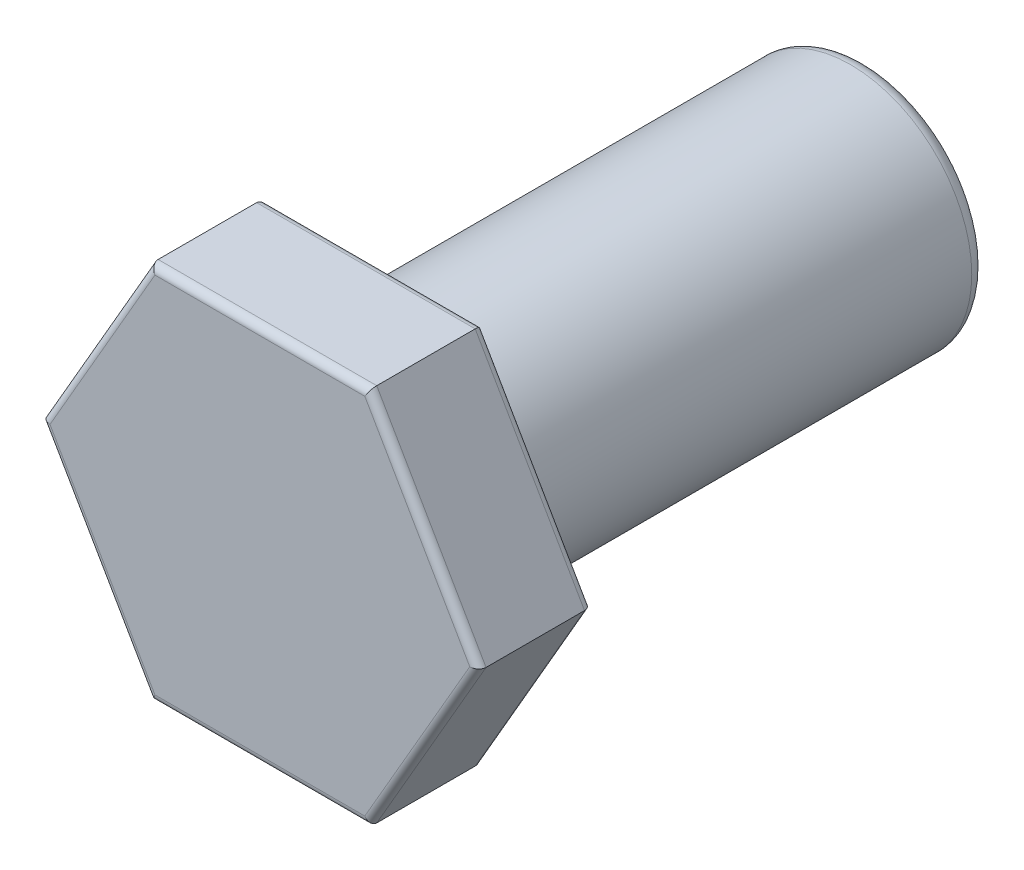
from build123d import *

# Parameters (mm, degrees)
SKETCH_1_R      = 8
EXTRUDE_1_DEPTH = 32.5
EXTRUDE_2_DEPTH = 7.5
FILLET_1_R      = 1
FILLET_2_R      = 0.5


with BuildPart() as part:
    # 草图1 → 凸台-拉伸1 (new body)
    with BuildSketch(Plane.XY):
        Circle(SKETCH_1_R)
    extrude(amount=EXTRUDE_1_DEPTH)

    # 草图2 → 凸台-拉伸2 (add)
    with BuildSketch(Plane.XY.offset(32.5)):
        Polygon((7.216878365, -12.5), (14.43375673, 0), (7.216878365, 12.5), (-7.216878365, 12.5), (-14.43375673, 0), (-7.216878365, -12.5), align=None)
    extrude(amount=EXTRUDE_2_DEPTH)

    # 圆角1
    fillet_1_edges = [part.edges().sort_by_distance(p)[0] for p in [
        (-8, 0, 0),
    ]]
    fillet(fillet_1_edges, radius=FILLET_1_R)

    # 圆角2
    fillet_2_edges = [part.edges().sort_by_distance(p)[0] for p in [
        (0, -12.5, 32.5),
        (10.825317547, -6.25, 32.5),
        (10.825317547, 6.25, 32.5),
        (0, 12.5, 32.5),
        (-10.825317547, 6.25, 32.5),
        (-10.825317547, -6.25, 32.5),
        (0, -12.5, 40),
        (10.825317547, -6.25, 40),
        (10.825317547, 6.25, 40),
        (0, 12.5, 40),
        (-10.825317547, 6.25, 40),
        (-10.825317547, -6.25, 40),
    ]]
    fillet(fillet_2_edges, radius=FILLET_2_R)


solid = part.part
